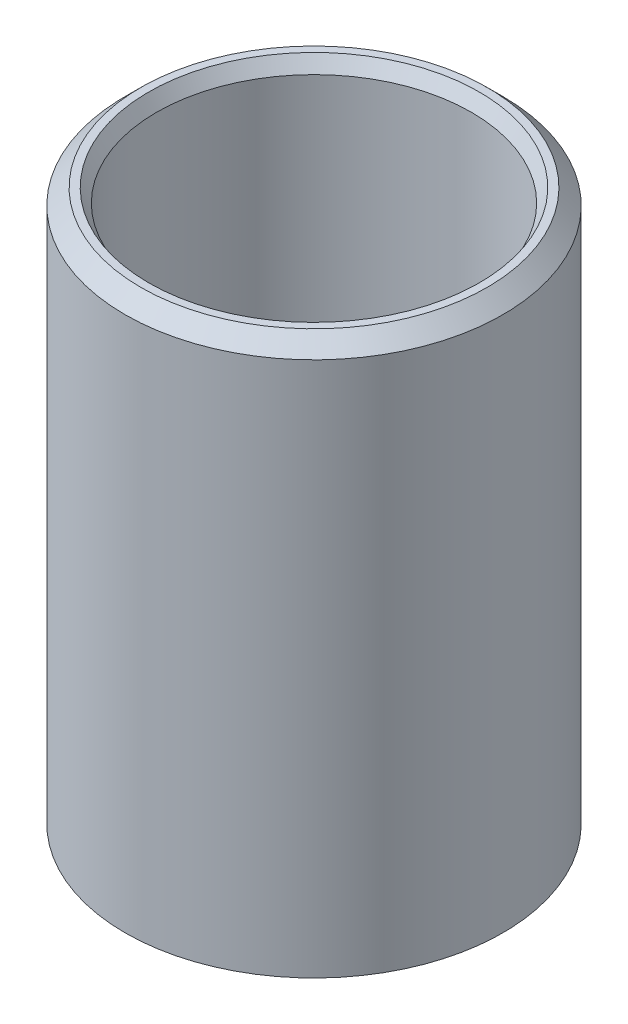
from build123d import *
from OCP.BRepFilletAPI import BRepFilletAPI_MakeChamfer

# Parameters (mm, degrees)
SKETCH2_R           = 30.48
BOSS_EXTRUDE2_DEPTH = 12.7
SKETCH3_R           = 4.125
CUT_EXTRUDE1_DEPTH  = 5.08
SKETCH4_R           = 2
CUT_EXTRUDE2_DEPTH  = 44.773567367
SKETCH5_R           = 30.48
SKETCH5_R_2         = 25.4
BOSS_EXTRUDE3_DEPTH = 76.2
CHAMFER1_SIZE       = 1.27
CHAMFER1_SIZE2      = 2.199704526
CHAMFER2_SIZE       = 2.54
CHAMFER3_SIZE       = 0.635
CHAMFER3_SIZE2      = 0.366617421


with BuildPart() as part:
    # Sketch2 → Boss-Extrude2 (new body)
    with BuildSketch(Plane(origin=(0, 0, 0), x_dir=(1, 0, 0), z_dir=(0, 1, 0))):
        with Locations(Location((0, 0, 0), (0, 0, 270))):
            Circle(SKETCH2_R)
    extrude(amount=BOSS_EXTRUDE2_DEPTH)

    # Sketch3 → Cut-Extrude1 (cut)
    with BuildSketch(Plane(origin=(0, 12.7, 0), x_dir=(1, 0, 0), z_dir=(0, 1, 0))):
        with Locations(Location((0, 15.24, 0), (0, 0, 270))):
            Circle(SKETCH3_R)
        with Locations(Location((0, -15.24, 0), (0, 0, 270))):
            Circle(SKETCH3_R)
    extrude(amount=-CUT_EXTRUDE1_DEPTH, mode=Mode.SUBTRACT)

    # Sketch4 → Cut-Extrude2 (cut, through all)
    with BuildSketch(Plane(origin=(0, 7.62, 0), x_dir=(1, 0, 0), z_dir=(0, 1, 0))):
        with Locations(Location((0, 15.24, 0), (0, 0, 270))):
            Circle(SKETCH4_R)
        with Locations(Location((0, -15.24, 0), (0, 0, 270))):
            Circle(SKETCH4_R)
    extrude(amount=-CUT_EXTRUDE2_DEPTH, mode=Mode.SUBTRACT)

    # Sketch5 → Boss-Extrude3 (add)
    with BuildSketch(Plane(origin=(0, 12.7, 0), x_dir=(1, 0, 0), z_dir=(0, 1, 0))):
        with Locations(Location((0, 0, 0), (0, 0, 270))):
            Circle(SKETCH5_R)
        with Locations(Location((0, 0, 0), (0, 0, 90))):
            Circle(SKETCH5_R_2, mode=Mode.SUBTRACT)
    extrude(amount=BOSS_EXTRUDE3_DEPTH)

    # Chamfer1
    chamfer1_edges = [part.edges().sort_by_distance(p)[0] for p in [
        (0, 88.9, 25.4),
    ]]
    chamfer1_side = [part.faces().sort_by_distance(p)[0] for p in [
        (0, 88.9, -29.617895412),
    ]]
    chamfer(chamfer1_edges, length=CHAMFER1_SIZE, length2=CHAMFER1_SIZE2, reference=chamfer1_side[0])

    # Chamfer2
    chamfer2_edges = [part.edges().sort_by_distance(p)[0] for p in [
        (0, 88.9, -30.48),
    ]]
    chamfer(chamfer2_edges, length=CHAMFER2_SIZE)

    # Chamfer3: one chamfer whose edges measure the first distance from different faces: ONE call of the kernel's chamfer builder (chamfer() names one face for all edges)
    chamfer3_edges_1 = [part.edges().sort_by_distance(p)[0] for p in [
        (0, 0, -17.24),
    ]]
    chamfer3_side_1 = [part.faces().sort_by_distance(p)[0] for p in [
        (0, 3.81, -17.24),
    ]]
    chamfer3_edges_2 = [part.edges().sort_by_distance(p)[0] for p in [
        (0, 0, 13.24),
    ]]
    chamfer3_side_2 = [part.faces().sort_by_distance(p)[0] for p in [
        (0, 3.81, 13.24),
    ]]
    chamfer3 = BRepFilletAPI_MakeChamfer(part.part.solid().wrapped)
    for e in chamfer3_edges_1:
        chamfer3.Add(CHAMFER3_SIZE, CHAMFER3_SIZE2, e.wrapped, chamfer3_side_1[0].wrapped)  # the first distance lies on this face
    for e in chamfer3_edges_2:
        chamfer3.Add(CHAMFER3_SIZE, CHAMFER3_SIZE2, e.wrapped, chamfer3_side_2[0].wrapped)  # the first distance lies on this face
    add(Compound.cast(chamfer3.Shape()), mode=Mode.REPLACE)


solid = part.part
